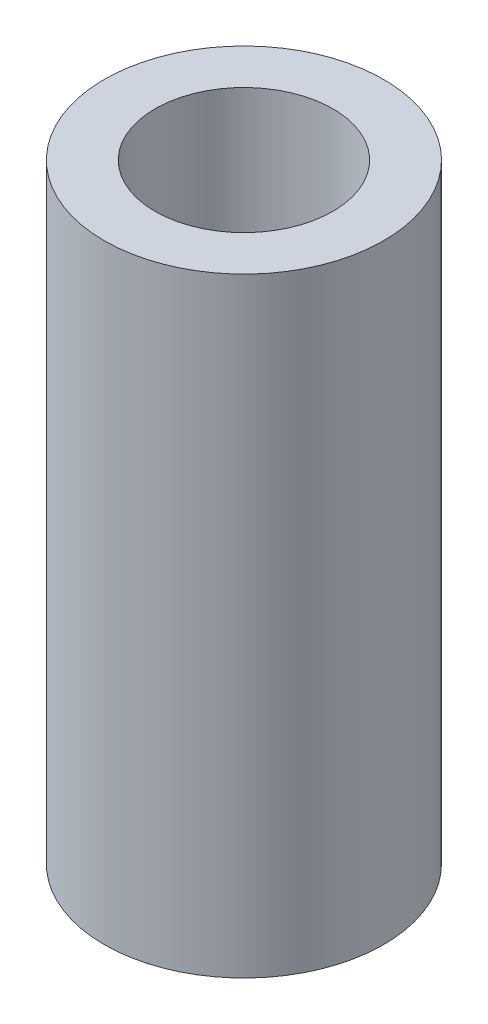
from build123d import *

# Parameters (mm, degrees)
SKETCH1_R           = 2.75
SKETCH1_R_2         = 1.75
BOSS_EXTRUDE1_DEPTH = 12


with BuildPart() as part:
    # Sketch1 → Boss-Extrude1 (new body)
    with BuildSketch(Plane(origin=(0, 0, 0), x_dir=(1, 0, 0), z_dir=(0, 1, 0))):
        with Locations(Location((0, 0, 0), (0, 0, 270))):
            Circle(SKETCH1_R)
        with Locations(Location((0, 0, 0), (0, 0, 270))):
            Circle(SKETCH1_R_2, mode=Mode.SUBTRACT)
    extrude(amount=BOSS_EXTRUDE1_DEPTH)


solid = part.part
